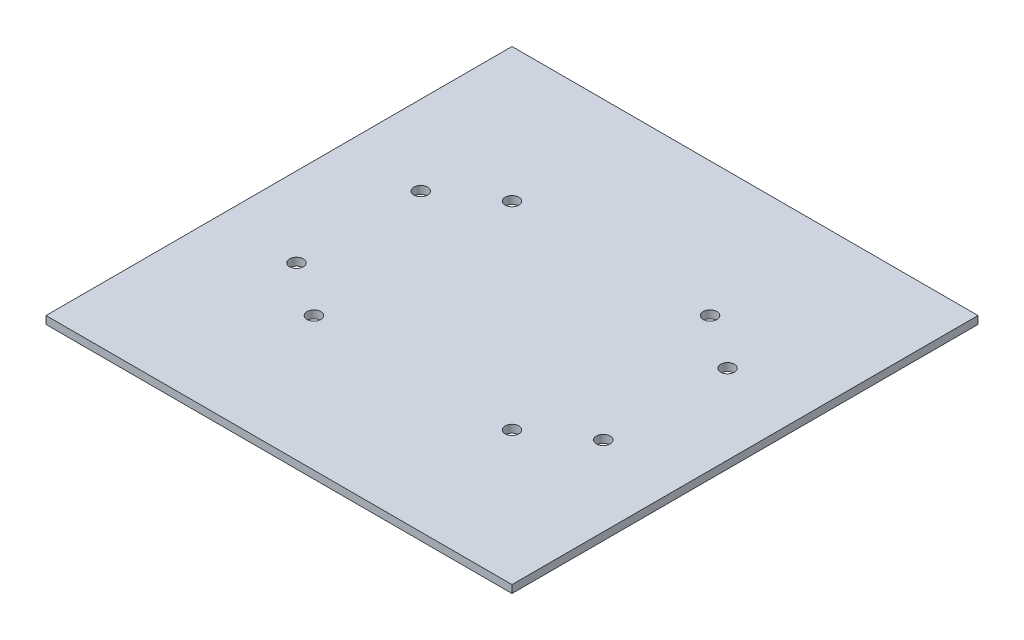
from build123d import *

# Parameters (mm, degrees)
SKETCH1_W           = 120
SKETCH1_H           = 120
BOSS_EXTRUDE1_DEPTH = 2
SKETCH2_R           = 1.775
CUT_EXTRUDE1_DEPTH  = 182.037166061
SKETCH3_R           = 1.775
CUT_EXTRUDE2_DEPTH  = 182.037166061


with BuildPart() as part:
    # Sketch1 → Boss-Extrude1 (new body)
    with BuildSketch(Plane(origin=(0, 0, 0), x_dir=(1, 0, 0), z_dir=(0, 1, 0))):
        with Locations((104.879995502, 14.733142437)):
            Rectangle(SKETCH1_W, SKETCH1_H)
    extrude(amount=BOSS_EXTRUDE1_DEPTH)

    # Sketch2 → Cut-Extrude1 (cut, through all)
    with BuildSketch(Plane(origin=(0, 2, 0), x_dir=(1, 0, 0), z_dir=(0, 1, 0))):
        with Locations(Location((65.379995502, 30.733142437, 0), (0, 0, 270))):
            Circle(SKETCH2_R)
        with Locations(Location((65.379995502, -1.266857563, 0), (0, 0, 270))):
            Circle(SKETCH2_R)
        with Locations(Location((144.379995502, -1.266857563, 0), (0, 0, 270))):
            Circle(SKETCH2_R)
        with Locations(Location((144.379995502, 30.733142437, 0), (0, 0, 270))):
            Circle(SKETCH2_R)
    extrude(amount=-CUT_EXTRUDE1_DEPTH, mode=Mode.SUBTRACT)

    # Sketch3 → Cut-Extrude2 (cut, through all)
    with BuildSketch(Plane(origin=(0, 2, 0), x_dir=(1, 0, 0), z_dir=(0, 1, 0))):
        with Locations(Location((79.379995502, -10.766857563, 0), (0, 0, 270))):
            Circle(SKETCH3_R)
        with Locations(Location((79.379995502, 40.233142437, 0), (0, 0, 270))):
            Circle(SKETCH3_R)
        with Locations(Location((130.379995502, -10.766857563, 0), (0, 0, 270))):
            Circle(SKETCH3_R)
        with Locations(Location((130.379995502, 40.233142437, 0), (0, 0, 270))):
            Circle(SKETCH3_R)
    extrude(amount=-CUT_EXTRUDE2_DEPTH, mode=Mode.SUBTRACT)


solid = part.part
